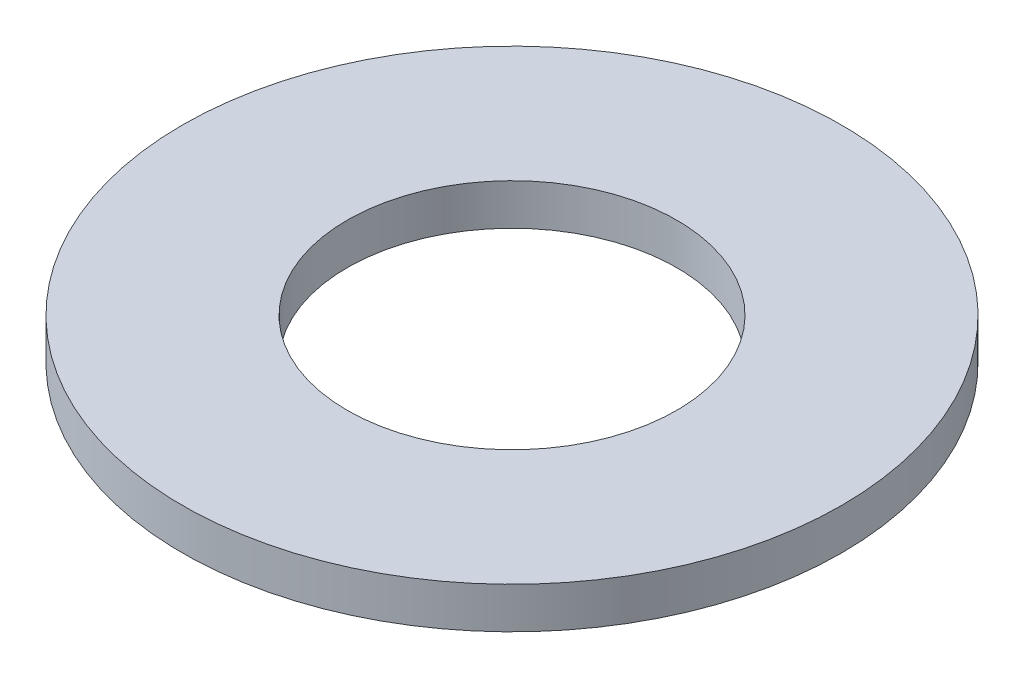
from build123d import *

# Parameters (mm, degrees)
SKETCH1_R           = 16
SKETCH1_R_2         = 8
EXTRUDE_THIN1_DEPTH = 2


with BuildPart() as part:
    # Sketch1 → Extrude-Thin1 (new body)
    with BuildSketch(Plane(origin=(0, 0, 0), x_dir=(1, 0, 0), z_dir=(0, 1, 0))):
        Circle(SKETCH1_R)
        Circle(SKETCH1_R_2, mode=Mode.SUBTRACT)
    extrude(amount=EXTRUDE_THIN1_DEPTH)


solid = part.part
